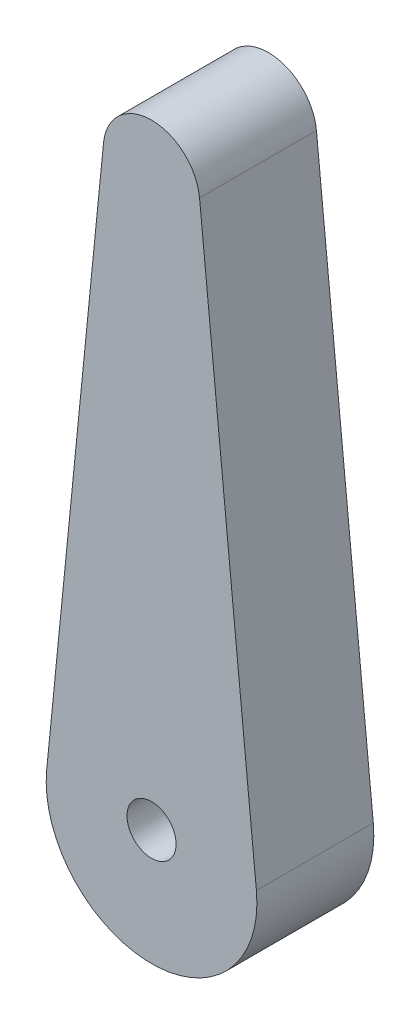
from build123d import *

# Parameters (mm, degrees)
BOSS_EXTRUDE1_DEPTH = 20
SKETCH2_R           = 4.2
CUT_EXTRUDE1_DEPTH  = 17.5


with BuildPart() as part:
    # Sketch1 → Boss-Extrude1 (new body)
    with BuildSketch(Plane(origin=(0, 0, 0), x_dir=(0, 1, 0), z_dir=(0, 0, 1))):
        with BuildLine():
            Line((0, 17.937538258), (97.753832512, 8.211917185))
            ThreePointArc((97.753832512, 8.211917185), (105.189280841, 0), (97.753832512, -8.211917185))
            Line((97.753832512, -8.211917185), (0, -17.937538258))
            ThreePointArc((0, -17.937538258), (-19.810719159, 0), (0, 17.937538258))
        make_face()
    extrude(amount=BOSS_EXTRUDE1_DEPTH)

    # Sketch2 → Cut-Extrude1 (cut)
    with BuildSketch(Plane.XY.offset(20)):
        Circle(SKETCH2_R)
    extrude(amount=-CUT_EXTRUDE1_DEPTH, mode=Mode.SUBTRACT)


solid = part.part
